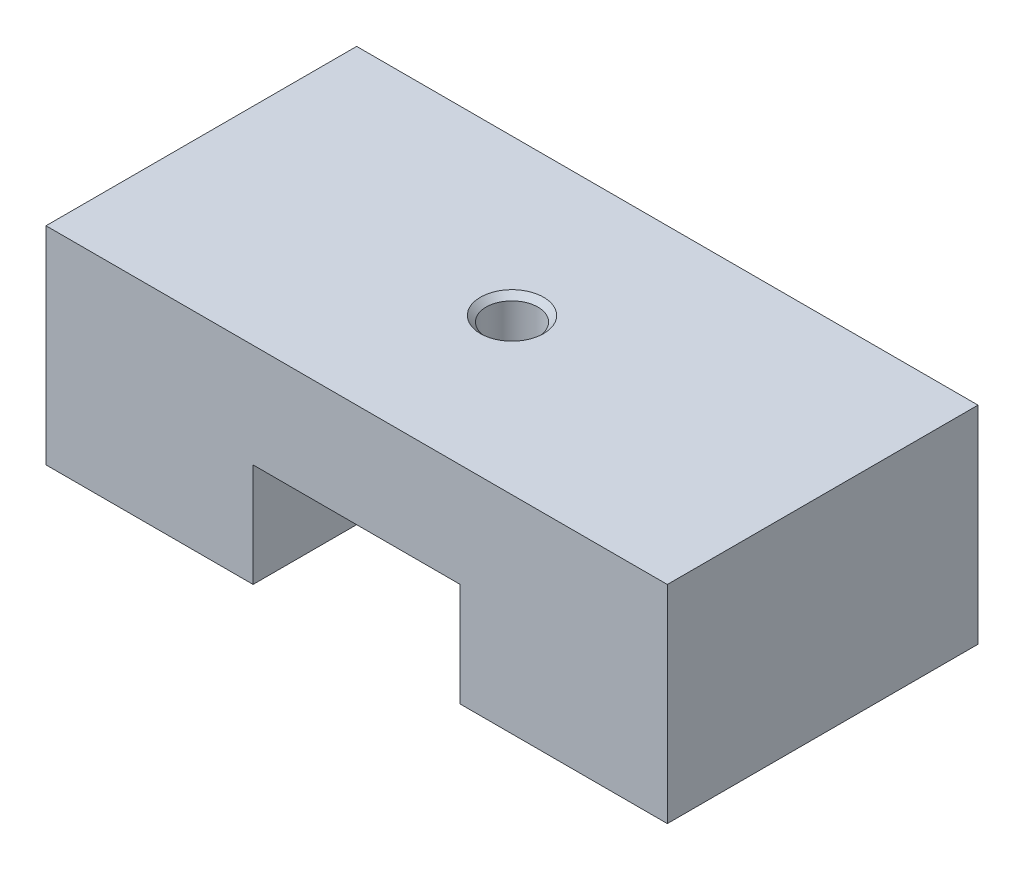
from build123d import *

# Parameters (mm, degrees)
BOSS_EXTRUDE1_DEPTH             = 15
M3X0_5_TAPPED_HOLE1_D           = 2.5
M3X0_5_TAPPED_HOLE1_CSINK_D     = 3.05
M3X0_5_TAPPED_HOLE1_CSINK_ANGLE = 90


with BuildPart() as part:
    # Sketch1 → Boss-Extrude1 (new body)
    with BuildSketch(Plane.XY):
        Polygon((-15, 0), (15, 0), (15, -10), (5, -10), (5, -5), (-5, -5), (-5, -10), (-15, -10), align=None)
    extrude(amount=BOSS_EXTRUDE1_DEPTH)

    # M3x0.5 Tapped Hole1 (through all)
    with Locations(Plane(origin=(0, 0, 0), x_dir=(1, 0, 0), z_dir=(0, 1, 0))):
        with Locations((0, -7.5)):
            CounterSinkHole(M3X0_5_TAPPED_HOLE1_D / 2, M3X0_5_TAPPED_HOLE1_CSINK_D / 2, counter_sink_angle=M3X0_5_TAPPED_HOLE1_CSINK_ANGLE)


solid = part.part
